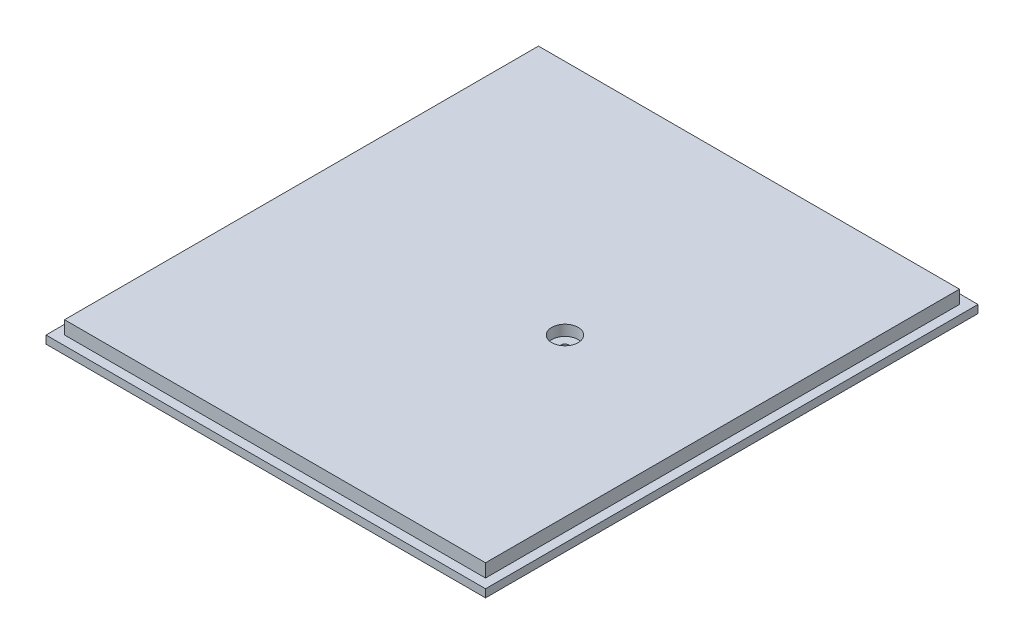
from build123d import *

# Parameters (mm, degrees)
SKETCH1_W           = 166
SKETCH1_H           = 186
BOSS_EXTRUDE2_DEPTH = 3
SKETCH2_W           = 159
SKETCH2_H           = 179
BOSS_EXTRUDE3_DEPTH = 5
CUT_EXTRUDE3_DEPTH  = 4
SKETCH6_R           = 1.5
CUT_EXTRUDE6_DEPTH  = 8
SKETCH7_R           = 5
CUT_EXTRUDE7_DEPTH  = 4


with BuildPart() as part:
    # Sketch1 → Boss-Extrude2 (new body)
    with BuildSketch(Plane(origin=(0, 0, 0), x_dir=(1, 0, 0), z_dir=(0, 1, 0))):
        with Locations((17.194373402, -43.436061381)):
            Rectangle(SKETCH1_W, SKETCH1_H)
    extrude(amount=BOSS_EXTRUDE2_DEPTH)

    # Sketch2 → Boss-Extrude3 (add)
    with BuildSketch(Plane(origin=(0, 3, 0), x_dir=(1, 0, 0), z_dir=(0, 1, 0))):
        with Locations((17.194373402, -43.436061381)):
            Rectangle(SKETCH2_W, SKETCH2_H)
    extrude(amount=BOSS_EXTRUDE3_DEPTH)

    # Sketch3 → Cut-Extrude3 (cut)
    # profile 1 of 7: a face of its own
    with BuildSketch(Plane(origin=(0, 0, 0), x_dir=(-1, 0, 0), z_dir=(0, -1, 0))):
        Polygon((-17.194373402, 11.312336055), (-1.319373402, 9.21665797), (-1.319373402, 9.013132329), (-14.345014427, 2.45897067), (-1.319373402, -4.079290548), (-1.319373402, -4.285996277), (-17.194373402, -6.394394714), (-17.194373402, -4.963355051), (-5.771496799, -3.44327292), (-17.194373402, 2.287245911), (-17.194373402, 2.608434813), (-5.746056094, 8.36121426), (-17.194373402, 9.878116303), align=None)
    # profile 2 of 7: a face of its own
    with BuildSketch(Plane(origin=(0, 0, 0), x_dir=(-1, 0, 0), z_dir=(0, -1, 0))):
        with BuildLine():
            Line((-13.530911863, -18.764937583), (-14.195550285, -20.030612663))
            add(Edge.make_bspline(
                [(-14.195550285, -20.030612663), (-14.374439332, -19.929739311), (-14.722486577, -19.733479715), (-15.200896923, -19.396219016), (-15.629799101, -19.042247533), (-16.002553475, -18.659356954), (-16.325735708, -18.252263129), (-16.606631327, -17.820368049), (-16.84863569, -17.365114918), (-17.051442149, -16.884898921), (-17.207563016, -16.375571151), (-17.317786146, -15.83571485), (-17.385931292, -15.264346582), (-17.393846206, -14.872704638), (-17.397899043, -14.672164145)],
                knots=[0, 0, 0, 0, 1.120373846, 2.179803828, 3.190307243, 4.151866639, 5.090753574, 6.023181945, 6.960194942, 7.901556876, 8.864247182, 9.862852693, 10.905672442, 12, 12, 12, 12], degree=3))
            add(Edge.make_bspline(
                [(-17.397899043, -14.672164145), (-17.392695783, -14.449270177), (-17.38254573, -14.014468617), (-17.295040629, -13.381556179), (-17.152290982, -12.785656723), (-16.952875919, -12.226803464), (-16.692401727, -11.706366027), (-16.375086461, -11.223306211), (-16.002554404, -10.775098046), (-15.571600692, -10.375811321), (-15.110349452, -10.01651009), (-14.629947934, -9.698889747), (-14.130151831, -9.43520422), (-13.618733913, -9.213457062), (-13.090987651, -9.045447241), (-12.549805465, -8.922463749), (-11.992505738, -8.852921762), (-11.615620684, -8.842137181), (-11.425693514, -8.836702407)],
                knots=[0, 0, 0, 0, 1.145226127, 2.234004399, 3.276654467, 4.290038057, 5.276870678, 6.260645262, 7.254731018, 8.264593254, 9.273837991, 10.257612574, 11.220387342, 12.174754112, 13.118989047, 14.062768009, 15.023752772, 16, 16, 16, 16], degree=3))
            add(Edge.make_bspline(
                [(-11.425693514, -8.836702407), (-11.24746339, -8.841506369), (-10.894234822, -8.851027188), (-10.371423245, -8.91103826), (-9.863294192, -9.017393018), (-9.369425446, -9.16333563), (-8.89064391, -9.351800211), (-8.426658193, -9.582360634), (-7.977962022, -9.855376061), (-7.694919237, -10.066162832), (-7.552346158, -10.172339426)],
                knots=[0, 0, 0, 0, 1.024358464, 2.0301432, 3.019427413, 4.004406732, 4.986367066, 5.972626655, 6.978780325, 8, 8, 8, 8], degree=3))
            add(Edge.make_bspline(
                [(-7.552346158, -10.172339426), (-7.380583783, -10.316156416), (-7.042500029, -10.599234638), (-6.598279766, -11.078008107), (-6.226152643, -11.59644114), (-5.917691704, -12.14803673), (-5.683314805, -12.739205737), (-5.508655414, -13.36200145), (-5.410783721, -14.023515359), (-5.396959619, -14.475749754), (-5.389886222, -14.707145115)],
                knots=[0, 0, 0, 0, 1.030682036, 2.02871468, 2.997146059, 3.962720338, 4.930598197, 5.918074684, 6.934738563, 8, 8, 8, 8], degree=3))
            add(Edge.make_bspline(
                [(-5.389886222, -14.707145115), (-5.396027801, -14.945032468), (-5.408076179, -15.411713226), (-5.519774191, -16.092216061), (-5.696905421, -16.736109311), (-5.947067256, -17.343135312), (-6.269826652, -17.913355609), (-6.669612861, -18.443063763), (-7.134152043, -18.941318838), (-7.491399457, -19.231189892), (-7.673189507, -19.378694594)],
                knots=[0, 0, 0, 0, 1.056321875, 2.072262726, 3.055038591, 4.01806755, 4.982017516, 5.957941055, 6.960871419, 8, 8, 8, 8], degree=3))
            add(Edge.make_bspline(
                [(-7.673189507, -19.378694594), (-7.810184323, -19.479056064), (-8.083262076, -19.679110969), (-8.528538395, -19.92969603), (-8.994404305, -20.147217071), (-9.488390296, -20.32108443), (-10.004643391, -20.461870739), (-10.546854219, -20.563728453), (-11.114861317, -20.62346208), (-11.501878194, -20.635203671), (-11.699181094, -20.641189586)],
                knots=[0, 0, 0, 0, 0.94817472, 1.890038105, 2.849395472, 3.817997239, 4.812318967, 5.836947057, 6.897266129, 8, 8, 8, 8], degree=3))
            Line((-11.699181094, -20.641189586), (-11.699181094, -10.261381894))
            add(Edge.make_bspline(
                [(-11.699181094, -10.261381894), (-11.852033679, -10.26837174), (-12.152612124, -10.282116991), (-12.592487833, -10.346044991), (-13.011307685, -10.44730063), (-13.407287189, -10.588048908), (-13.78172648, -10.764532726), (-14.137206149, -10.97392576), (-14.468327563, -11.225263795), (-14.779381637, -11.505138203), (-15.056284469, -11.816816627), (-15.304317472, -12.144597306), (-15.511053688, -12.492782431), (-15.681388426, -12.857861993), (-15.812489452, -13.241729317), (-15.902770073, -13.643844589), (-15.963082071, -14.062956901), (-15.969799657, -14.348639315), (-15.973219555, -14.49407921)],
                knots=[0, 0, 0, 0, 1.094405546, 2.152104367, 3.174987145, 4.173015398, 5.153654967, 6.133208507, 7.119289451, 8.123438607, 9.122504012, 10.097966803, 11.060604936, 12.014205423, 12.976096155, 13.956823727, 14.959826266, 16, 16, 16, 16], degree=3))
            add(Edge.make_bspline(
                [(-15.973219555, -14.49407921), (-15.970480765, -14.636282679), (-15.965046478, -14.918441642), (-15.911419996, -15.339612306), (-15.826127701, -15.754195313), (-15.708897131, -16.159212933), (-15.564483475, -16.545859038), (-15.391377921, -16.904957035), (-15.202079784, -17.237716687), (-14.982170056, -17.546928857), (-14.715784883, -17.846852923), (-14.379551907, -18.140630479), (-13.985974728, -18.459887976), (-13.688546144, -18.659268061), (-13.530911863, -18.764937583)],
                knots=[0, 0, 0, 0, 0.990963276, 1.966261236, 2.95471375, 3.93937425, 4.902926125, 5.828461241, 6.715766441, 7.568835615, 8.469155523, 9.505141836, 10.677749234, 12, 12, 12, 12], degree=3))
        make_face()
        with BuildLine():
            add(Edge.make_bspline(
                [(-10.274501607, -19.216510099), (-10.085485046, -19.164453622), (-9.721689013, -19.064261661), (-9.219107985, -18.853560695), (-8.769854459, -18.621663032), (-8.381346254, -18.341759885), (-8.038701965, -18.021885076), (-7.736238596, -17.656313499), (-7.466948153, -17.245905609), (-7.239410974, -16.793488234), (-7.045798497, -16.314310254), (-6.915958729, -15.812636725), (-6.827016609, -15.300744847), (-6.818733747, -14.954514495), (-6.814565709, -14.780287142)],
                knots=[0, 0, 0, 0, 1.154756201, 2.222533969, 3.206705588, 4.129403772, 5.035894089, 5.963342549, 6.920206228, 7.923656548, 8.944970878, 9.96070521, 10.973801891, 12, 12, 12, 12], degree=3))
            add(Edge.make_bspline(
                [(-6.814565709, -14.780287142), (-6.817351786, -14.638098983), (-6.822859275, -14.357022885), (-6.874715318, -13.942850448), (-6.961547398, -13.54437865), (-7.077185161, -13.159413479), (-7.236510568, -12.79465567), (-7.419537322, -12.440612962), (-7.644403572, -12.106030618), (-7.815645199, -11.896738112), (-7.902155853, -11.79100429)],
                knots=[0, 0, 0, 0, 1.048700258, 2.073059931, 3.073189922, 4.055269162, 5.032885305, 6.005420607, 6.992345662, 8, 8, 8, 8], degree=3))
            add(Edge.make_bspline(
                [(-7.902155853, -11.79100429), (-7.970619356, -11.715288332), (-8.109172801, -11.562057688), (-8.347883845, -11.35731318), (-8.605292716, -11.161277464), (-8.891247388, -10.982871253), (-9.202491636, -10.819233629), (-9.536400196, -10.666108018), (-9.895506894, -10.528283935), (-10.145753314, -10.450740864), (-10.274501607, -10.410846037)],
                knots=[0, 0, 0, 0, 0.879870761, 1.780643979, 2.707998968, 3.669668524, 4.684282772, 5.740141944, 6.837334558, 8, 8, 8, 8], degree=3))
            Line((-10.274501607, -10.410846037), (-10.274501607, -19.216510099))
        make_face(mode=Mode.SUBTRACT)
    # profile 3 of 7: a face of its own
    with BuildSketch(Plane(origin=(0, 0, 0), x_dir=(-1, 0, 0), z_dir=(0, -1, 0))):
        with BuildLine():
            Line((-5.593411863, -23.490548561), (-5.593411863, -24.915228048))
            Line((-5.593411863, -24.915228048), (-7.609587744, -24.915228048))
            add(Edge.make_bspline(
                [(-7.609587744, -24.915228048), (-7.433465656, -25.043794232), (-7.096570638, -25.289721972), (-6.647678348, -25.689127857), (-6.272987711, -26.094999718), (-6.073718552, -26.385234106), (-5.978202528, -26.524352647)],
                knots=[0, 0, 0, 0, 1.134266299, 2.169680534, 3.122669868, 4, 4, 4, 4], degree=3))
            add(Edge.make_bspline(
                [(-5.978202528, -26.524352647), (-5.887463907, -26.714238793), (-5.707571975, -27.090693553), (-5.525084047, -27.686773609), (-5.412938052, -28.296712288), (-5.397601108, -28.708592402), (-5.389886222, -28.915778929)],
                knots=[0, 0, 0, 0, 1.014936303, 2.012140481, 3.000054389, 4, 4, 4, 4], degree=3))
            add(Edge.make_bspline(
                [(-5.389886222, -28.915778929), (-5.394639944, -29.055895632), (-5.404047305, -29.333179052), (-5.464914505, -29.744117103), (-5.571393699, -30.143296474), (-5.715946803, -30.528127854), (-5.896600485, -30.88850064), (-6.104331336, -31.219507344), (-6.338976122, -31.517083321), (-6.609620466, -31.780746525), (-6.924123394, -32.017818231), (-7.290896873, -32.235891874), (-7.718197018, -32.437391418), (-8.02828795, -32.549066718), (-8.191543874, -32.607861261)],
                knots=[0, 0, 0, 0, 1.009798505, 1.998336943, 2.985959917, 3.981996858, 4.955664737, 5.886087062, 6.794002107, 7.679958053, 8.601272429, 9.625787331, 10.750030247, 12, 12, 12, 12], degree=3))
            add(Edge.make_bspline(
                [(-8.191543874, -32.607861261), (-8.079400974, -32.67005158), (-7.858719495, -32.792433394), (-7.54639807, -32.997926812), (-7.254267342, -33.213227202), (-6.982095069, -33.440169269), (-6.731226935, -33.677952572), (-6.500827619, -33.927694067), (-6.289929219, -34.187979756), (-6.043470373, -34.54987165), (-5.782709638, -35.020035792), (-5.553686209, -35.612985834), (-5.415098997, -36.231027321), (-5.398332137, -36.651178053), (-5.389886222, -36.862819194)],
                knots=[0, 0, 0, 0, 0.861170869, 1.694663331, 2.509326413, 3.297991968, 4.073691563, 4.829592376, 5.579160782, 6.321830913, 7.768780219, 9.179854006, 10.579417172, 12, 12, 12, 12], degree=3))
            add(Edge.make_bspline(
                [(-5.389886222, -36.862819194), (-5.397221474, -37.057317257), (-5.411577274, -37.437968852), (-5.524305528, -37.992130021), (-5.717879141, -38.508937496), (-5.982010279, -38.987351377), (-6.313930146, -39.418969102), (-6.708849516, -39.794146647), (-7.163974985, -40.110605081), (-7.592110077, -40.317336768), (-7.970095336, -40.457559573), (-8.292159586, -40.544015886), (-8.646632701, -40.620395932), (-9.03393853, -40.683810866), (-9.455445218, -40.730159298), (-9.910462976, -40.764497901), (-10.399345447, -40.787739234), (-10.736646109, -40.789381491), (-10.910519235, -40.790228048)],
                knots=[0, 0, 0, 0, 1.209669288, 2.367440248, 3.500751976, 4.631527125, 5.755587489, 6.87532382, 8.007944318, 9.190864318, 9.82315674, 10.514484317, 11.263564316, 12.079023757, 12.955305781, 13.901327259, 14.918167583, 16, 16, 16, 16], degree=3))
            Line((-10.910519235, -40.790228048), (-17.194373402, -40.790228048))
            Line((-17.194373402, -40.790228048), (-17.194373402, -39.365548561))
            Line((-17.194373402, -39.365548561), (-10.904159059, -39.365548561))
            add(Edge.make_bspline(
                [(-10.904159059, -39.365548561), (-10.755747884, -39.365195306), (-10.470524177, -39.364516403), (-10.061164844, -39.352298861), (-9.688019085, -39.329278684), (-9.351595671, -39.302360865), (-9.051110138, -39.26496928), (-8.787165818, -39.216682443), (-8.557687161, -39.165529901), (-8.303295238, -39.080549614), (-8.022680636, -38.944709055), (-7.719996803, -38.737823504), (-7.456727371, -38.477071557), (-7.226818171, -38.175664544), (-7.043658466, -37.83165945), (-6.90790521, -37.454110104), (-6.827654379, -37.044289899), (-6.819002033, -36.760354652), (-6.814565709, -36.614772319)],
                knots=[0, 0, 0, 0, 1.253542879, 2.409118771, 3.458568974, 4.411070626, 5.259544058, 6.014735414, 6.677123945, 7.243402448, 8.276608576, 9.299873988, 10.325604302, 11.392892819, 12.490509435, 13.603538441, 14.771260462, 16, 16, 16, 16], degree=3))
            add(Edge.make_bspline(
                [(-6.814565709, -36.614772319), (-6.821128873, -36.434878229), (-6.834137887, -36.078305555), (-6.962024648, -35.558657509), (-7.15962521, -35.060652449), (-7.441746557, -34.597676867), (-7.7812021, -34.17124786), (-8.184613387, -33.804296156), (-8.641052496, -33.501168354), (-9.063536694, -33.295908274), (-9.443037774, -33.166235515), (-9.774586474, -33.080615184), (-10.151420758, -33.014015527), (-10.571008296, -32.951556337), (-11.036237332, -32.910790572), (-11.544955792, -32.873741169), (-12.098693752, -32.856410827), (-12.482536232, -32.853986674), (-12.681828329, -32.852728048)],
                knots=[0, 0, 0, 0, 1.090512009, 2.161531735, 3.230072964, 4.332825141, 5.440581378, 6.529496625, 7.62916386, 8.757669174, 9.370357692, 10.061947597, 10.834545503, 11.692923569, 12.636967211, 13.669242667, 14.789864225, 16, 16, 16, 16], degree=3))
            Line((-12.681828329, -32.852728048), (-17.194373402, -32.852728048))
            Line((-17.194373402, -32.852728048), (-17.194373402, -31.428048561))
            Line((-17.194373402, -31.428048561), (-11.2953099, -31.428048561))
            add(Edge.make_bspline(
                [(-11.2953099, -31.428048561), (-11.128877606, -31.427704427), (-10.808678601, -31.427042349), (-10.34953638, -31.414690779), (-9.931801416, -31.3923176), (-9.556522597, -31.363420812), (-9.22268011, -31.332057926), (-8.931369075, -31.282425302), (-8.681377295, -31.230688231), (-8.404543565, -31.151732737), (-8.104245948, -31.014975558), (-7.781667486, -30.806953204), (-7.497379124, -30.548531447), (-7.256304053, -30.241497467), (-7.058698856, -29.894794898), (-6.914122669, -29.513351477), (-6.830733955, -29.099576989), (-6.820056761, -28.814395031), (-6.814565709, -28.667732054)],
                knots=[0, 0, 0, 0, 1.320226356, 2.539982809, 3.643122147, 4.638255983, 5.52602392, 6.301561104, 6.98107216, 7.550523949, 8.58191082, 9.584830316, 10.584890324, 11.614493144, 12.668965657, 13.738783174, 14.837104585, 16, 16, 16, 16], degree=3))
            add(Edge.make_bspline(
                [(-6.814565709, -28.667732054), (-6.821507439, -28.495301382), (-6.835342059, -28.151653176), (-6.959866799, -27.646819224), (-7.154921005, -27.159294943), (-7.425520858, -26.696857289), (-7.76070612, -26.271979137), (-8.154926677, -25.900009286), (-8.603279832, -25.587319964), (-9.021304649, -25.379847083), (-9.391313433, -25.246153255), (-9.705813886, -25.156910426), (-10.055470914, -25.082071542), (-10.439519452, -25.018636685), (-10.858756598, -24.970902859), (-11.311997512, -24.942343982), (-11.800673686, -24.917240324), (-12.137994838, -24.91591526), (-12.312938105, -24.915228048)],
                knots=[0, 0, 0, 0, 1.098813768, 2.189896819, 3.297771711, 4.440532809, 5.596253211, 6.739894833, 7.8864334, 9.072265856, 9.705655743, 10.395080422, 11.156654178, 11.986235968, 12.878145268, 13.847797945, 14.883813667, 16, 16, 16, 16], degree=3))
            Line((-12.312938105, -24.915228048), (-17.194373402, -24.915228048))
            Line((-17.194373402, -24.915228048), (-17.194373402, -23.490548561))
            Line((-17.194373402, -23.490548561), (-5.593411863, -23.490548561))
        make_face()
    # profile 4 of 7: a face of its own
    with BuildSketch(Plane(origin=(0, 0, 0), x_dir=(-1, 0, 0), z_dir=(0, -1, 0))):
        with BuildLine():
            add(Edge.make_bspline(
                [(-5.389886222, -49.649953609), (-5.394507626, -49.867633714), (-5.40356907, -50.294451202), (-5.50089385, -50.919431882), (-5.648480663, -51.515396288), (-5.856228303, -52.084900929), (-6.12880132, -52.623234852), (-6.458423209, -53.135204493), (-6.847324043, -53.619784099), (-7.148330624, -53.910162156), (-7.301119195, -54.057555772)],
                knots=[0, 0, 0, 0, 1.054042676, 2.066720093, 3.05716247, 4.025731183, 4.997454851, 5.974904663, 6.97207755, 8, 8, 8, 8], degree=3))
            add(Edge.make_bspline(
                [(-7.301119195, -54.057555772), (-7.44723263, -54.184473921), (-7.736631804, -54.435854003), (-8.205876906, -54.758187799), (-8.69183379, -55.035871304), (-9.200955594, -55.258406877), (-9.728797852, -55.433871091), (-10.277174831, -55.558447642), (-10.844875477, -55.632547311), (-11.2304286, -55.64253934), (-11.425693514, -55.647599843)],
                knots=[0, 0, 0, 0, 1.025258237, 2.030674902, 3.01204498, 3.988269485, 4.97094183, 5.956517959, 6.965070386, 8, 8, 8, 8], degree=3))
            add(Edge.make_bspline(
                [(-11.425693514, -55.647599843), (-11.622090204, -55.643148777), (-12.010179224, -55.634353264), (-12.581767057, -55.551151859), (-13.136007876, -55.421743013), (-13.670581176, -55.236541433), (-14.187121372, -54.999060113), (-14.683370955, -54.709269813), (-15.160314347, -54.365139356), (-15.613881099, -53.975043906), (-16.031969255, -53.543937733), (-16.396139552, -53.076152749), (-16.709450902, -52.580542602), (-16.95830723, -52.050341724), (-17.158902762, -51.493097355), (-17.297226292, -50.905265073), (-17.381607398, -50.287369274), (-17.392392106, -49.86541424), (-17.397899043, -49.649953609)],
                knots=[0, 0, 0, 0, 0.998669827, 1.973418153, 2.932281609, 3.89081133, 4.846438734, 5.82045571, 6.809776312, 7.834649874, 8.860672198, 9.859676908, 10.845817165, 11.837296335, 12.833502054, 13.853824644, 14.904110009, 16, 16, 16, 16], degree=3))
            add(Edge.make_bspline(
                [(-17.397899043, -49.649953609), (-17.392346541, -49.43344771), (-17.381471687, -49.009409969), (-17.297853967, -48.389187532), (-17.157424833, -47.798880293), (-16.960790559, -47.23900003), (-16.707406874, -46.708801301), (-16.397358617, -46.211361106), (-16.031784847, -45.743355476), (-15.613931065, -45.312114143), (-15.160301473, -44.922054933), (-14.683374297, -44.577915124), (-14.187120501, -44.288127254), (-13.670581409, -44.050645298), (-13.136007814, -43.865443888), (-12.581767074, -43.736034996), (-12.010179219, -43.652833603), (-11.622090203, -43.644038089), (-11.425693514, -43.639587022)],
                knots=[0, 0, 0, 0, 1.099861214, 2.154133753, 3.1731438, 4.178222029, 5.163564916, 6.153006591, 7.15072618, 8.175428628, 9.198983792, 10.187031731, 11.15979573, 12.114193814, 13.071490482, 14.029120454, 15.002614863, 16, 16, 16, 16], degree=3))
            add(Edge.make_bspline(
                [(-11.425693514, -43.639587022), (-11.231489895, -43.644682037), (-10.847000105, -43.654769291), (-10.280366652, -43.728794457), (-9.73291778, -43.852885052), (-9.207112942, -44.0285596), (-8.700222215, -44.253146359), (-8.213064588, -44.526927915), (-7.74594135, -44.852549713), (-7.456916202, -45.102929993), (-7.310659459, -45.229631093)],
                knots=[0, 0, 0, 0, 1.031353054, 2.041901799, 3.029428768, 4.008703097, 4.981709435, 5.96992636, 6.972712378, 8, 8, 8, 8], degree=3))
            add(Edge.make_bspline(
                [(-7.310659459, -45.229631093), (-7.156571605, -45.376814694), (-6.853530726, -45.666277144), (-6.465397213, -46.153093639), (-6.131331228, -46.662860963), (-5.858895387, -47.204667324), (-5.648857605, -47.775755515), (-5.500205017, -48.376149248), (-5.403999564, -49.003404731), (-5.394637553, -49.432289505), (-5.389886222, -49.649953609)],
                knots=[0, 0, 0, 0, 1.027951202, 2.021646915, 2.998468564, 3.9668038, 4.943370589, 5.93035926, 6.949632805, 8, 8, 8, 8], degree=3))
        make_face()
        with BuildLine():
            add(Edge.make_bspline(
                [(-6.814565709, -49.643593432), (-6.818941058, -49.489662297), (-6.827578807, -49.185773733), (-6.893270247, -48.73846098), (-6.997366191, -48.307848791), (-7.14520234, -47.893065243), (-7.336326584, -47.495714578), (-7.569751438, -47.115359595), (-7.846720142, -46.753022174), (-8.161727685, -46.411485845), (-8.503881118, -46.094360502), (-8.871800588, -45.820339241), (-9.254931201, -45.586903651), (-9.655261693, -45.392641861), (-10.07658338, -45.247906796), (-10.514195149, -45.142804162), (-10.968969568, -45.077170319), (-11.278128591, -45.068614378), (-11.435233778, -45.064266509)],
                knots=[0, 0, 0, 0, 1.021589593, 2.016807015, 2.994807536, 3.958602519, 4.934347097, 5.916793557, 6.916107818, 7.957073844, 8.998039869, 10.008589932, 10.997041759, 11.972786337, 12.956492182, 13.948170289, 14.957322718, 16, 16, 16, 16], degree=3))
            add(Edge.make_bspline(
                [(-11.435233778, -45.064266509), (-11.638225157, -45.071535371), (-12.041125086, -45.085962701), (-12.634315062, -45.203880322), (-13.204864704, -45.399746988), (-13.745904444, -45.669833999), (-14.247361806, -46.002454279), (-14.698274632, -46.391385479), (-15.081253914, -46.842004708), (-15.403345938, -47.338967517), (-15.656993104, -47.87523131), (-15.838891851, -48.441805397), (-15.955545069, -49.033530949), (-15.967276498, -49.438459545), (-15.973219555, -49.643593432)],
                knots=[0, 0, 0, 0, 1.016977094, 2.018509362, 3.018404954, 4.033172147, 5.041280572, 6.028085189, 7.007940189, 7.995502847, 8.989109012, 9.972200833, 10.97273166, 12, 12, 12, 12], degree=3))
            add(Edge.make_bspline(
                [(-15.973219555, -49.643593432), (-15.967310925, -49.848739119), (-15.955647452, -50.253691007), (-15.838300847, -50.846239869), (-15.657784064, -51.414366754), (-15.403059458, -51.951188125), (-15.082471337, -52.448377251), (-14.696092835, -52.895778749), (-14.248547174, -53.288059373), (-13.746569341, -53.621009008), (-13.20402359, -53.886744169), (-12.63442019, -54.083531939), (-12.041098312, -54.201166761), (-11.638216187, -54.215632263), (-11.435233778, -54.222920355)],
                knots=[0, 0, 0, 0, 1.027082318, 2.027431966, 3.015401697, 4.008827937, 4.996211763, 5.971861488, 6.96198607, 7.969911943, 8.982141629, 9.981856156, 10.983207064, 12, 12, 12, 12], degree=3))
            add(Edge.make_bspline(
                [(-11.435233778, -54.222920355), (-11.278116047, -54.218604838), (-10.968932339, -54.210112557), (-10.514337468, -54.144015676), (-10.075717843, -54.040545711), (-9.656959593, -53.889472658), (-9.252975965, -53.701878046), (-8.872951066, -53.462763865), (-8.503647228, -53.190018939), (-8.161933912, -52.872311679), (-7.845569176, -52.5308138), (-7.570760373, -52.165754301), (-7.336193285, -51.785222671), (-7.145178802, -51.387746433), (-6.997935216, -50.97390152), (-6.892816789, -50.544596693), (-6.827818324, -50.099264853), (-6.819011501, -49.796455372), (-6.814565709, -49.643593432)],
                knots=[0, 0, 0, 0, 1.043020522, 2.052505155, 3.044509714, 4.030878336, 5.003918577, 5.996372628, 7.007255355, 8.048564058, 9.08987276, 10.095126797, 11.077896669, 12.053962454, 13.01807471, 13.98956039, 14.985105429, 16, 16, 16, 16], degree=3))
        make_face(mode=Mode.SUBTRACT)
    # profile 5 of 7: a face of its own
    with BuildSketch(Plane(origin=(0, 0, 0), x_dir=(-1, 0, 0), z_dir=(0, -1, 0))):
        Polygon((-17.194373402, -58.089907535), (-1.319373402, -60.18558562), (-1.319373402, -60.389111261), (-14.345014427, -66.94327292), (-1.319373402, -73.481534137), (-1.319373402, -73.688239867), (-17.194373402, -75.796638304), (-17.194373402, -74.365598641), (-5.771496799, -72.845516509), (-17.194373402, -67.114997679), (-17.194373402, -66.793808777), (-5.746056094, -61.04102933), (-17.194373402, -59.524127287), align=None)
    # profile 6 of 7: a face of its own
    with BuildSketch(Plane(origin=(0, 0, 0), x_dir=(-1, 0, 0), z_dir=(0, -1, 0))):
        with BuildLine():
            Line((-5.593411863, -90.450484458), (-17.194373402, -90.450484458))
            Line((-17.194373402, -90.450484458), (-17.194373402, -89.025804971))
            Line((-17.194373402, -89.025804971), (-15.187737785, -89.025804971))
            add(Edge.make_bspline(
                [(-15.187737785, -89.025804971), (-15.369394961, -88.865189049), (-15.723901224, -88.551745058), (-16.185654008, -88.028323693), (-16.570469243, -87.475805125), (-16.878384459, -86.892320986), (-17.11144025, -86.279617045), (-17.275331837, -85.63944058), (-17.382020786, -84.972644788), (-17.392558806, -84.517913051), (-17.397899043, -84.287473641)],
                knots=[0, 0, 0, 0, 1.074295371, 2.096500925, 3.086030275, 4.053105238, 5.014108356, 5.985331429, 6.979048527, 8, 8, 8, 8], degree=3))
            add(Edge.make_bspline(
                [(-17.397899043, -84.287473641), (-17.392337491, -84.08260415), (-17.381369866, -83.678592445), (-17.296256145, -83.084289993), (-17.159641264, -82.512342016), (-16.969410415, -81.962384001), (-16.718377766, -81.438142363), (-16.414593588, -80.93666314), (-16.056378379, -80.456775969), (-15.645267423, -80.007607299), (-15.199214734, -79.593462655), (-14.722073742, -79.23112792), (-14.220397965, -78.924037436), (-13.694328405, -78.671664057), (-13.144249617, -78.476364303), (-12.570538966, -78.340488518), (-11.974151078, -78.255466517), (-11.568023652, -78.244504448), (-11.362091751, -78.238945996)],
                knots=[0, 0, 0, 0, 1.034036272, 2.039165313, 3.024406509, 3.999331371, 4.971254918, 5.953351348, 6.95522652, 7.989525907, 9.023492927, 10.024309745, 11.009187477, 11.988246066, 12.964946762, 13.950187958, 14.960617622, 16, 16, 16, 16], degree=3))
            add(Edge.make_bspline(
                [(-11.362091751, -78.238945996), (-11.160416236, -78.244627732), (-10.761714622, -78.255860218), (-10.175355807, -78.339578756), (-9.610530692, -78.480252691), (-9.069331597, -78.678046885), (-8.549578937, -78.930554468), (-8.055339263, -79.242926215), (-7.579052102, -79.605130381), (-7.135991137, -80.023701184), (-6.728215575, -80.476901307), (-6.369129834, -80.9594734), (-6.066124531, -81.46540027), (-5.819810677, -81.995696374), (-5.624074695, -82.546606746), (-5.487627868, -83.122316357), (-5.407418976, -83.720207113), (-5.395786628, -84.12610615), (-5.389886222, -84.331994875)],
                knots=[0, 0, 0, 0, 1.02050356, 2.017480486, 2.990790918, 3.96161403, 4.928589988, 5.909588639, 6.91611943, 7.952353252, 8.989586576, 9.99823133, 10.991940466, 11.968822692, 12.952985106, 13.945868367, 14.958059758, 16, 16, 16, 16], degree=3))
            add(Edge.make_bspline(
                [(-5.389886222, -84.331994875), (-5.3963757, -84.568767737), (-5.409101259, -85.033068146), (-5.516129686, -85.713073255), (-5.694723879, -86.356954909), (-5.94017759, -86.968424525), (-6.263933075, -87.545110066), (-6.676023609, -88.07991407), (-7.167034992, -88.583603005), (-7.545279392, -88.875538422), (-7.739971358, -89.025804971)],
                knots=[0, 0, 0, 0, 1.03879612, 2.037030165, 3.012306674, 3.966139504, 4.922386257, 5.905048148, 6.921675258, 8, 8, 8, 8], degree=3))
            Line((-7.739971358, -89.025804971), (-5.593411863, -89.025804971))
            Line((-5.593411863, -89.025804971), (-5.593411863, -90.450484458))
        make_face()
        with BuildLine():
            add(Edge.make_bspline(
                [(-6.814565709, -84.351075404), (-6.821975343, -84.14282096), (-6.836600783, -83.731759813), (-6.950781718, -83.128312045), (-7.140753937, -82.550847962), (-7.400584575, -82.002296746), (-7.727225898, -81.491170895), (-8.122607164, -81.034804576), (-8.574155115, -80.62773784), (-9.085666133, -80.291182082), (-9.627777198, -80.007432096), (-10.198769089, -79.812850054), (-10.782800828, -79.683368848), (-11.179078491, -79.670223741), (-11.377992192, -79.663625484)],
                knots=[0, 0, 0, 0, 1.031093775, 2.03521511, 3.029845951, 4.035119871, 5.034286494, 6.024708811, 7.017619509, 8.03559408, 9.050082311, 10.039808432, 11.016071318, 12, 12, 12, 12], degree=3))
            add(Edge.make_bspline(
                [(-11.377992192, -79.663625484), (-11.575677991, -79.672162081), (-11.970274729, -79.689201814), (-12.556041706, -79.809437023), (-13.124734937, -80.01776388), (-13.674355428, -80.295037242), (-14.186916385, -80.639142206), (-14.647294305, -81.042830554), (-15.044261218, -81.505016379), (-15.376522647, -82.017250904), (-15.643977301, -82.56351045), (-15.832571176, -83.138238252), (-15.951658054, -83.731336164), (-15.966008213, -84.135334803), (-15.973219555, -84.338355051)],
                knots=[0, 0, 0, 0, 0.979154363, 1.954470772, 2.947816011, 3.971783346, 4.997163654, 5.998045606, 6.995988793, 8.00538986, 9.015323546, 10.000094788, 10.994993517, 12, 12, 12, 12], degree=3))
            add(Edge.make_bspline(
                [(-15.973219555, -84.338355051), (-15.965803191, -84.544511896), (-15.951090291, -84.953494599), (-15.834999811, -85.558362671), (-15.647389644, -86.146258976), (-15.383840104, -86.708438369), (-15.058709094, -87.231762057), (-14.676398717, -87.700855189), (-14.235499648, -88.101407755), (-13.747051604, -88.437196904), (-13.214082835, -88.7024535), (-12.644216615, -88.88954241), (-12.041931269, -89.004449954), (-11.629735538, -89.018588207), (-11.419333337, -89.025804971)],
                knots=[0, 0, 0, 0, 1.017484689, 2.018529338, 3.030031036, 4.058138743, 5.076350332, 6.065651025, 7.036469986, 8.00785331, 8.984076697, 9.96571663, 10.961615403, 12, 12, 12, 12], degree=3))
            add(Edge.make_bspline(
                [(-11.419333337, -89.025804971), (-11.259051097, -89.021452175), (-10.943564924, -89.012884495), (-10.4803428, -88.947432538), (-10.037053778, -88.843311952), (-9.613212663, -88.696612062), (-9.211233341, -88.503835042), (-8.82796485, -88.271573337), (-8.466977287, -87.995062913), (-8.128727809, -87.682718689), (-7.821753642, -87.336974659), (-7.551189187, -86.969320692), (-7.322217208, -86.580681801), (-7.138979734, -86.171330791), (-6.989700757, -85.744420511), (-6.891104574, -85.295859107), (-6.823187021, -84.830167256), (-6.817469738, -84.512454133), (-6.814565709, -84.351075404)],
                knots=[0, 0, 0, 0, 1.050062701, 2.066855696, 3.059271411, 4.030305351, 4.999747758, 5.975466543, 6.961907836, 7.974539719, 8.98812422, 9.98710676, 10.961662635, 11.93785114, 12.922015094, 13.919620009, 14.94329489, 16, 16, 16, 16], degree=3))
        make_face(mode=Mode.SUBTRACT)
    # profile 7 of 7: a face of its own
    with BuildSketch(Plane(origin=(0, 0, 0), x_dir=(-1, 0, 0), z_dir=(0, -1, 0))):
        Polygon((-0.912322119, -95.131574202), (-0.912322119, -96.556253689), (-5.593411863, -96.556253689), (-5.593411863, -98.591510099), (-7.01809135, -98.591510099), (-7.01809135, -96.556253689), (-17.194373402, -96.556253689), (-17.194373402, -95.131574202), (-7.01809135, -95.131574202), (-7.01809135, -93.096317791), (-5.593411863, -93.096317791), (-5.593411863, -95.131574202), align=None)
    extrude(amount=-CUT_EXTRUDE3_DEPTH, mode=Mode.SUBTRACT)

    # Sketch6 → Cut-Extrude6 (cut)
    with BuildSketch(Plane.XZ):
        with Locations(Location((37.194373402, 43.436061381, 0), (0, 0, 270))):
            Circle(SKETCH6_R)
    extrude(amount=-CUT_EXTRUDE6_DEPTH, mode=Mode.SUBTRACT)

    # Sketch7 → Cut-Extrude7 (cut)
    with BuildSketch(Plane(origin=(0, 8, 0), x_dir=(1, 0, 0), z_dir=(0, 1, 0))):
        with Locations(Location((37.194373402, -43.436061381, 0), (0, 0, 270))):
            Circle(SKETCH7_R)
    extrude(amount=-CUT_EXTRUDE7_DEPTH, mode=Mode.SUBTRACT)


solid = part.part
